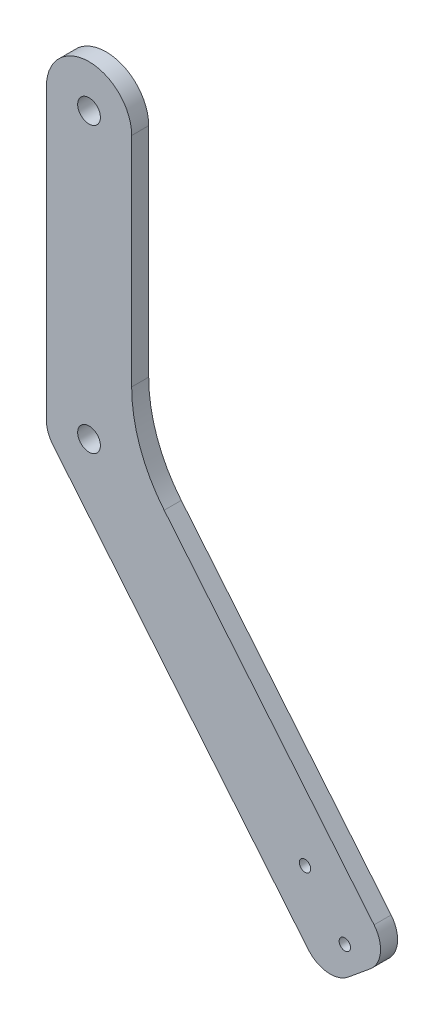
from build123d import *

# Parameters (mm, degrees)
SKETCH1_R           = 4
SKETCH1_R_2         = 2
BOSS_EXTRUDE1_DEPTH = 3
FILLET1_RADIUS      = 15
FILLET1_LENGTH      = 6
FILLET2_R           = 10
FILLET3_R           = 50


with BuildPart() as part:
    # Sketch1 → Boss-Extrude1 (new, symmetric)
    with BuildSketch(Plane.XY):
        Polygon((106.658484331, -105.600205114), (83.526408131, -124.702745538), (-15, -5.392940138), (-15, 115), (15, 115), (15, 5.392940138), align=None)
        with Locations((0, 100)):
            Circle(SKETCH1_R, mode=Mode.SUBTRACT)
        Circle(SKETCH1_R, mode=Mode.SUBTRACT)
        with Locations((75.989905807, -92.019399126)):
            Circle(SKETCH1_R_2, mode=Mode.SUBTRACT)
        with Locations((89.998435451, -108.982921673)):
            Circle(SKETCH1_R_2, mode=Mode.SUBTRACT)
    extrude(amount=BOSS_EXTRUDE1_DEPTH, both=True)

    # Fillet1: full round fillet: the end face becomes a half cylinder, R = half its width
    fillet1_face = Plane((0, 115, 0), x_dir=(0, 0, 1), z_dir=(0, 1, 0))  # on the end face: x along it, z out of the body
    fillet1_slab = fillet1_face.offset(-FILLET1_RADIUS / 2) * Box(FILLET1_LENGTH, 2 * FILLET1_RADIUS, FILLET1_RADIUS, mode=Mode.PRIVATE)  # the body's end, R deep
    fillet1_round = Plane((0, 100, 0), x_dir=(0, 1, 0), z_dir=(0, 0, 1)) * Cylinder(FILLET1_RADIUS, FILLET1_LENGTH, mode=Mode.PRIVATE)  # its axis R under the face
    add(fillet1_slab - fillet1_round, mode=Mode.SUBTRACT)

    # Fillet2
    fillet2_edges = [part.edges().sort_by_distance(p)[0] for p in [
        (106.658484331, -105.600205114, 0),
        (83.526408131, -124.702745538, 0),
        (-15, -5.392940138, 0),
    ]]
    fillet(fillet2_edges, radius=FILLET2_R)

    # Fillet3
    fillet3_edges = [part.edges().sort_by_distance(p)[0] for p in [
        (15, 5.392940138, 0),
    ]]
    fillet(fillet3_edges, radius=FILLET3_R)


solid = part.part
